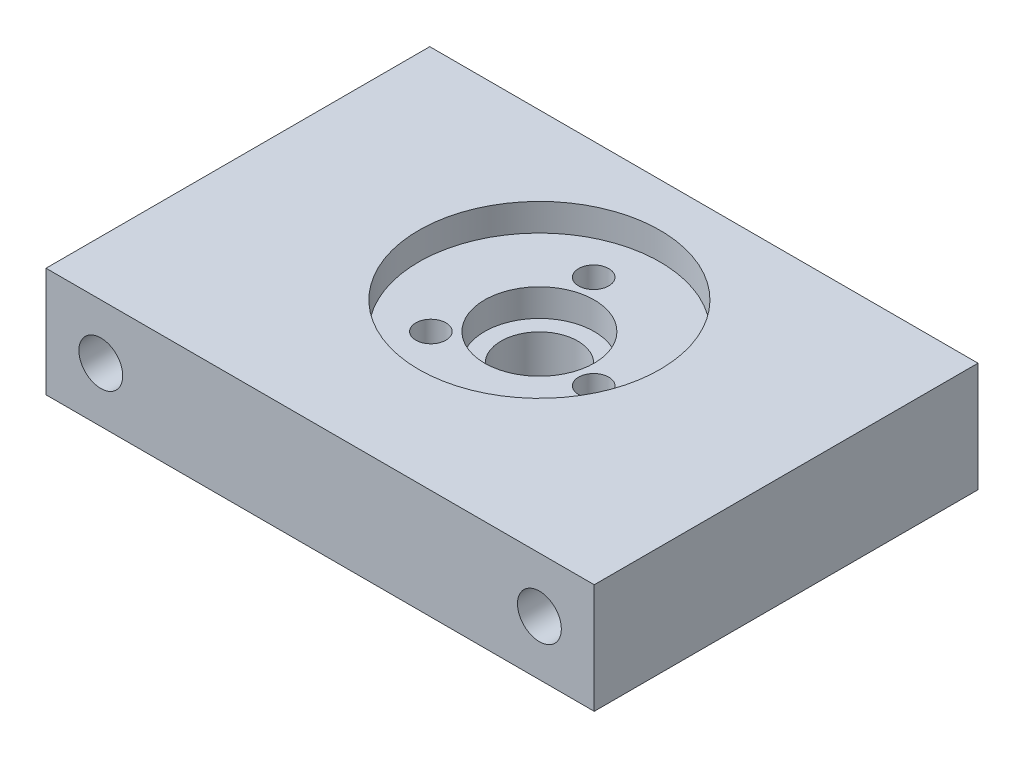
from build123d import *

# Parameters (mm, degrees)
ESQUISSE1_W             = 50
ESQUISSE1_H             = 35
BOSS_EXTRU_1_DEPTH      = 10
ESQUISSE2_R             = 5
ENL_V_MAT_EXTRU_1_DEPTH = 5
ESQUISSE3_R             = 1.375
ESQUISSE3_R_2           = 3.5
ENL_V_MAT_EXTRU_2_DEPTH = 15
ESQUISSE4_R             = 11
ENL_V_MAT_EXTRU_3_DEPTH = 2.5
ESQUISSE5_R             = 2.25
ENL_V_MAT_EXTRU_4_DEPTH = 2.5
ESQUISSE6_R             = 2
ENL_V_MAT_EXTRU_5_DEPTH = 10


with BuildPart() as part:
    # Esquisse1 → Boss.-Extru.1 (new body)
    with BuildSketch(Plane(origin=(0, 0, 0), x_dir=(1, 0, 0), z_dir=(0, 1, 0))):
        Rectangle(ESQUISSE1_W, ESQUISSE1_H)
    extrude(amount=BOSS_EXTRU_1_DEPTH)

    # Esquisse2 → Enlèv. mat.-Extru.1 (cut)
    with BuildSketch(Plane(origin=(0, 10, 0), x_dir=(1, 0, 0), z_dir=(0, 1, 0))):
        with Locations(Location((0, 2.5, 0), (0, 0, 270))):
            Circle(ESQUISSE2_R)
    extrude(amount=-ENL_V_MAT_EXTRU_1_DEPTH, mode=Mode.SUBTRACT)

    # Esquisse3 → Enlèv. mat.-Extru.2 (cut)
    with BuildSketch(Plane(origin=(0, 10, 0), x_dir=(1, 0, 0), z_dir=(0, 1, 0))):
        with Locations(Location((-1.811733316, 9.261480784, 0), (0, 0, 270))):
            Circle(ESQUISSE3_R)
        with Locations(Location((6.761480784, 0.688266684, 0), (0, 0, 270))):
            Circle(ESQUISSE3_R)
        with Locations(Location((-4.949747468, -2.449747468, 0), (0, 0, 270))):
            Circle(ESQUISSE3_R)
        with Locations(Location((0, 2.5, 0), (0, 0, 270))):
            Circle(ESQUISSE3_R_2)
    extrude(amount=-ENL_V_MAT_EXTRU_2_DEPTH, mode=Mode.SUBTRACT)

    # Esquisse4 → Enlèv. mat.-Extru.3 (cut)
    with BuildSketch(Plane(origin=(0, 10, 0), x_dir=(1, 0, 0), z_dir=(0, 1, 0))):
        with Locations(Location((0, 2.5, 0), (0, 0, 270))):
            Circle(ESQUISSE4_R)
    extrude(amount=-ENL_V_MAT_EXTRU_3_DEPTH, mode=Mode.SUBTRACT)

    # Esquisse5 → Enlèv. mat.-Extru.4 (cut)
    with BuildSketch(Plane.XZ):
        with Locations(Location((-4.949747468, 2.449747468, 0), (0, 0, 270))):
            Circle(ESQUISSE5_R)
        with Locations(Location((6.761480784, -0.688266684, 0), (0, 0, 270))):
            Circle(ESQUISSE5_R)
        with Locations(Location((-1.811733316, -9.261480784, 0), (0, 0, 270))):
            Circle(ESQUISSE5_R)
    extrude(amount=-ENL_V_MAT_EXTRU_4_DEPTH, mode=Mode.SUBTRACT)

    # Esquisse6 → Enlèv. mat.-Extru.5 (cut)
    with BuildSketch(Plane.XY.offset(17.5)):
        with Locations((-20, 5)):
            Circle(ESQUISSE6_R)
        with Locations((20, 5)):
            Circle(ESQUISSE6_R)
    extrude(amount=-ENL_V_MAT_EXTRU_5_DEPTH, mode=Mode.SUBTRACT)


solid = part.part
